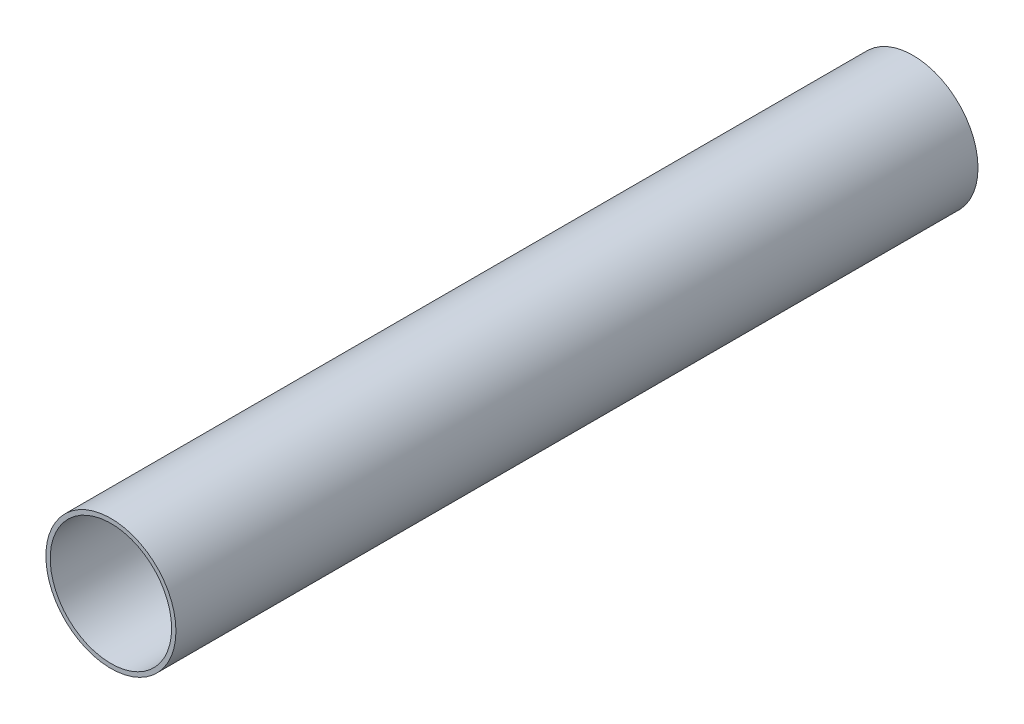
from build123d import *

# Parameters (mm, degrees)
SKETCH1_R           = 15
SKETCH1_R_2         = 14
BOSS_EXTRUDE1_DEPTH = 185


with BuildPart() as part:
    # Sketch1 → Boss-Extrude1 (new body)
    with BuildSketch(Plane.XY):
        Circle(SKETCH1_R)
        Circle(SKETCH1_R_2, mode=Mode.SUBTRACT)
    extrude(amount=BOSS_EXTRUDE1_DEPTH)


solid = part.part
